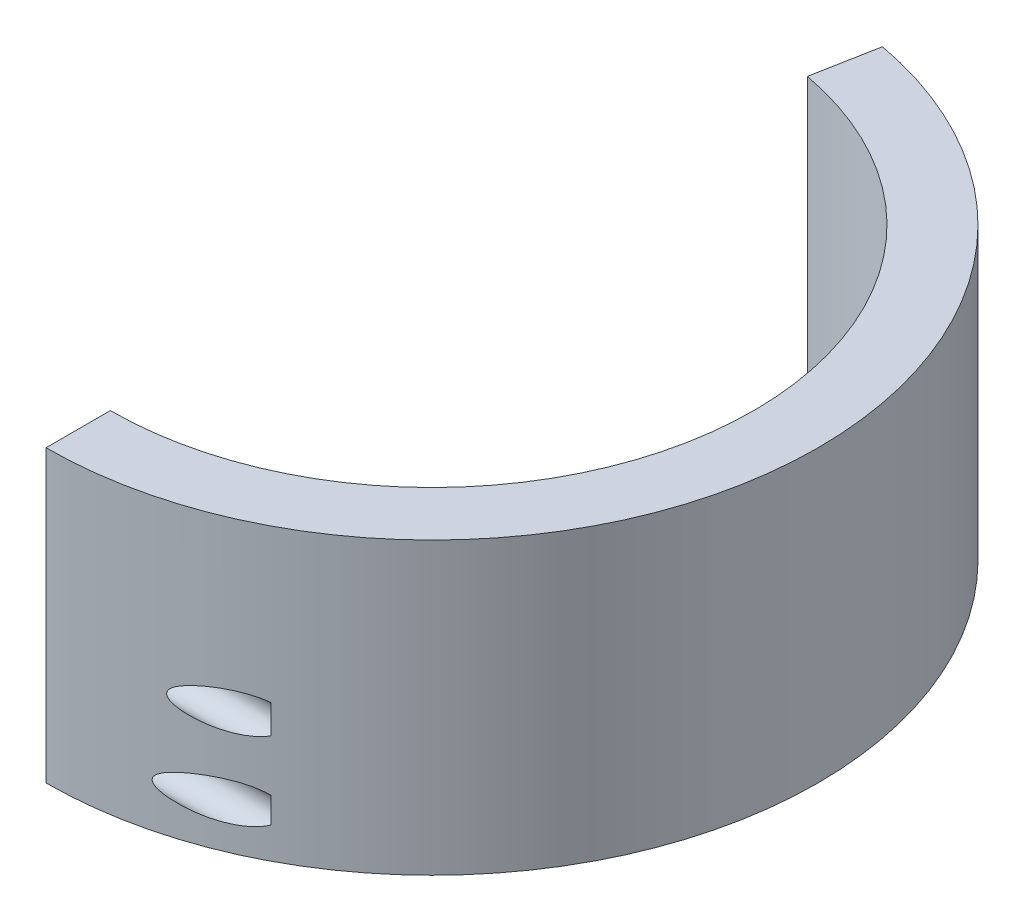
from build123d import *

# Parameters (mm, degrees)
BOSS_EXTRUDE1_DEPTH     = 27.94
CUT_EXTRUDE1_DEPTH      = 17.78
CUT_EXTRUDE1_DEPTH_BACK = 17.78
SKETCH2_R               = 1.5
SKETCH2_R_2             = 1.554918768
SKETCH2_R_3             = 1.519223358
SKETCH2_3_R             = 1.8175
SKETCH2_3_R_2           = 1.5
SKETCH2_3_R_3           = 1.872418768
SKETCH2_3_R_4           = 1.554918768
SKETCH2_3_R_5           = 1.836723358
SKETCH2_3_R_6           = 1.519223358
CUT_EXTRUDE2_DEPTH      = 17.78
BOSS_EXTRUDE2_START     = -0.7112
BOSS_EXTRUDE2_DEPTH     = 0.7112


with BuildPart() as part:
    # Sketch1 → Boss-Extrude1 (new body)
    with BuildSketch(Plane(origin=(0, 0, 0), x_dir=(1, 0, 0), z_dir=(0, 1, 0))):
        with BuildLine():
            Line((70.498234913, 37.451765087), (69.331862428, 31.209804239))
            ThreePointArc((69.331862428, 31.209804239), (72.423610275, 30.470176889), (75.425897806, 29.425082184))
            ThreePointArc((75.425897806, 29.425082184), (95.114662615, -2.928413856), (69.818170226, -31.115))
            ThreePointArc((69.818170226, -31.115), (66.675, -31.590851128), (63.5, -31.75))
            Line((63.5, -31.75), (63.5, -38.1))
            ThreePointArc((63.5, -38.1), (101.437595139, -3.514096627), (70.498234913, 37.451765087))
        make_face()
    extrude(amount=BOSS_EXTRUDE1_DEPTH)

    # Sketch2 → Cut-Extrude1 (cut, two sides: drawn at the far end of the back side and taken through both)
    with BuildSketch(Plane.ZY.offset(-63.5).offset(-CUT_EXTRUDE1_DEPTH_BACK)):
        with Locations((34.821497506, 11.418652896)):
            Circle(SKETCH2_R)
        with Locations((35.069922057, 3.654275356)):
            Circle(SKETCH2_R_2)
        with Locations((-34.532766251, 13.194759825)):
            Circle(SKETCH2_R_3)
        with Locations((-34.532766251, 3.654275356)):
            Circle(SKETCH2_R)
    extrude(amount=CUT_EXTRUDE1_DEPTH + CUT_EXTRUDE1_DEPTH_BACK, mode=Mode.SUBTRACT)

    # Sketch2<3> → Cut-Extrude2 (cut)
    # profile 1 of 4: a face of its own
    with BuildSketch(Plane.ZY.offset(-63.5)):
        with Locations((34.821497506, 11.418652896)):
            Circle(SKETCH2_3_R)
        with Locations((34.821497506, 11.418652896)):
            Circle(SKETCH2_3_R_2, mode=Mode.SUBTRACT)
    # profile 2 of 4: a face of its own
    with BuildSketch(Plane.ZY.offset(-63.5)):
        with Locations((35.069922057, 3.654275356)):
            Circle(SKETCH2_3_R_3)
        with Locations((35.069922057, 3.654275356)):
            Circle(SKETCH2_3_R_4, mode=Mode.SUBTRACT)
    # profile 3 of 4: a face of its own
    with BuildSketch(Plane.ZY.offset(-63.5)):
        with Locations((-34.532766251, 13.194759825)):
            Circle(SKETCH2_3_R_5)
        with Locations((-34.532766251, 13.194759825)):
            Circle(SKETCH2_3_R_6, mode=Mode.SUBTRACT)
    # profile 4 of 4: a face of its own
    with BuildSketch(Plane.ZY.offset(-63.5)):
        with Locations((-34.532766251, 3.654275356)):
            Circle(SKETCH2_3_R)
        with Locations((-34.532766251, 3.654275356)):
            Circle(SKETCH2_3_R_2, mode=Mode.SUBTRACT)
    extrude(amount=-CUT_EXTRUDE2_DEPTH, mode=Mode.SUBTRACT)

    # Sketch1<2> → Boss-Extrude2 (add)
    with BuildSketch(Plane(origin=(0, 0, 0), x_dir=(1, 0, 0), z_dir=(0, 1, 0)).offset(BOSS_EXTRUDE2_START)):
        with BuildLine():
            Line((70.498234913, 37.451765087), (69.331862428, 31.209804239))
            ThreePointArc((69.331862428, 31.209804239), (72.423610275, 30.470176889), (75.425897806, 29.425082184))
            ThreePointArc((75.425897806, 29.425082184), (95.114662615, -2.928413856), (69.818170226, -31.115))
            ThreePointArc((69.818170226, -31.115), (66.675, -31.590851128), (63.5, -31.75))
            Line((63.5, -31.75), (63.5, -38.1))
            ThreePointArc((63.5, -38.1), (101.437595139, -3.514096627), (70.498234913, 37.451765087))
        make_face()
    extrude(amount=BOSS_EXTRUDE2_DEPTH)


solid = part.part
